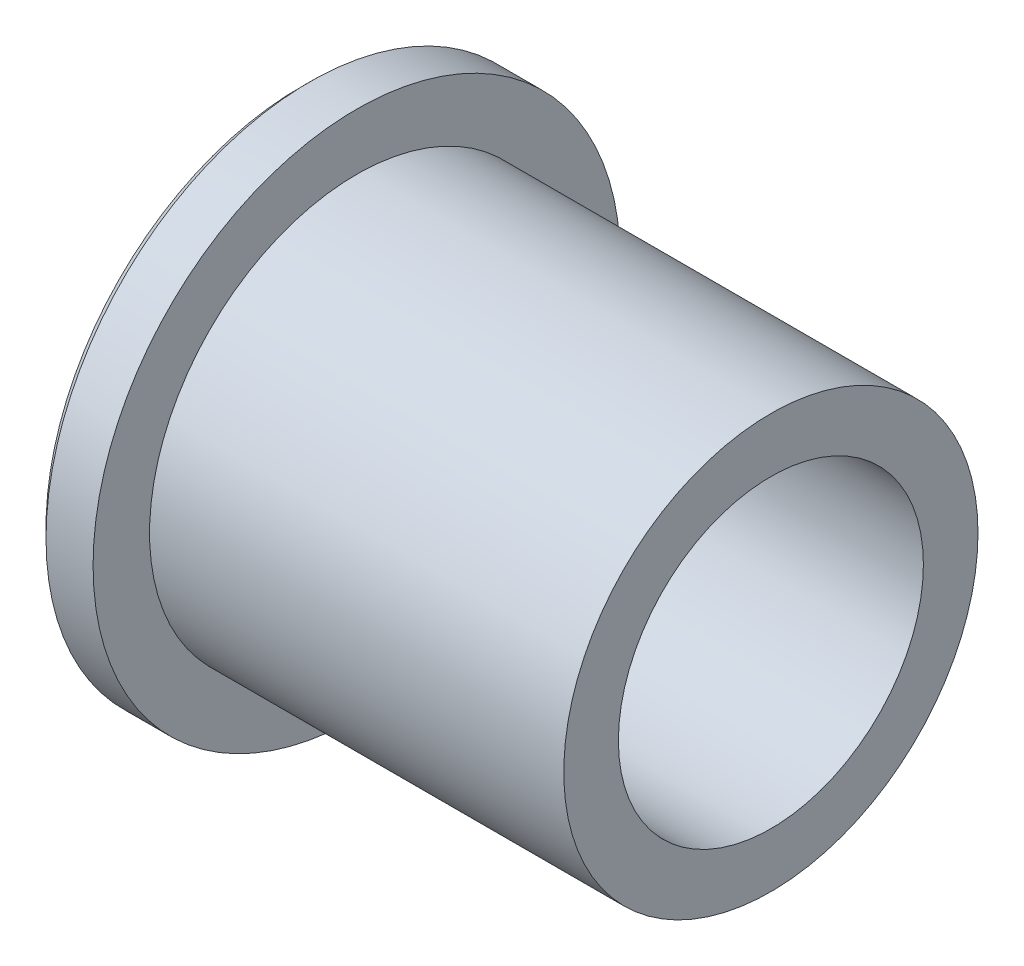
from build123d import *

# Parameters (mm, degrees)
SZKIC1_R                    = 14
SZKIC1_R_2                  = 8.1
DODANIE_WYCI_GNI_CIE1_DEPTH = 3
SZKIC2_R                    = 11
SZKIC2_R_2                  = 8.1
DODANIE_WYCI_GNI_CIE2_DEPTH = 22
SFAZOWANIE1_SIZE            = 0.5


with BuildPart() as part:
    # Szkic1 → Dodanie-wyciągnięcie1 (new body)
    with BuildSketch(Plane(origin=(0, 0, 0), x_dir=(0, 0, -1), z_dir=(1, 0, 0))):
        Circle(SZKIC1_R)
        Circle(SZKIC1_R_2, mode=Mode.SUBTRACT)
    extrude(amount=DODANIE_WYCI_GNI_CIE1_DEPTH)

    # Szkic2 → Dodanie-wyciągnięcie2 (add)
    with BuildSketch(Plane(origin=(3, 0, 0), x_dir=(0, 0, -1), z_dir=(1, 0, 0))):
        Circle(SZKIC2_R)
        Circle(SZKIC2_R_2, mode=Mode.SUBTRACT)
    extrude(amount=DODANIE_WYCI_GNI_CIE2_DEPTH)

    # Sfazowanie1
    sfazowanie1_edges = [part.edges().sort_by_distance(p)[0] for p in [
        (0, 0, 14),
    ]]
    chamfer(sfazowanie1_edges, length=SFAZOWANIE1_SIZE)


solid = part.part
